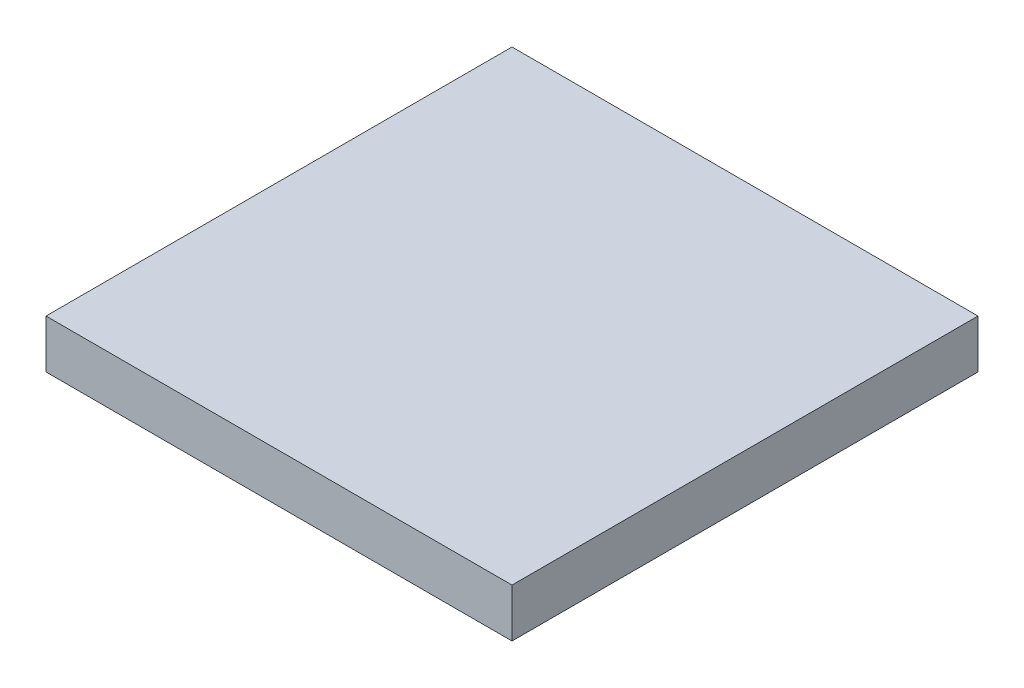
from build123d import *

# Parameters (mm, degrees)
SKETCH1_W           = 38.1
SKETCH1_H           = 38.1
BOSS_EXTRUDE1_DEPTH = 3.9624


with BuildPart() as part:
    # Sketch1 → Boss-Extrude1 (new body)
    with BuildSketch(Plane(origin=(0, 0, 0), x_dir=(1, 0, 0), z_dir=(0, 1, 0))):
        with Locations((19.05, 19.05)):
            Rectangle(SKETCH1_W, SKETCH1_H)
    extrude(amount=BOSS_EXTRUDE1_DEPTH)


solid = part.part
